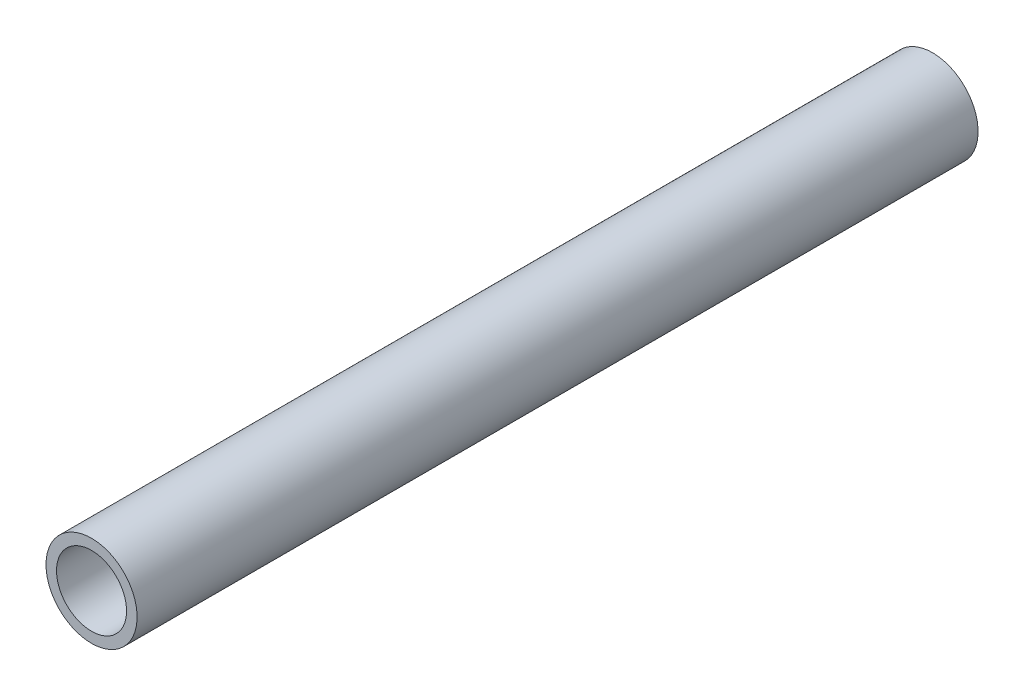
from build123d import *

# Parameters (mm, degrees)
SKETCH1_R           = 16.51
SKETCH1_R_2         = 12.7
BOSS_EXTRUDE1_DEPTH = 304.8


with BuildPart() as part:
    # Sketch1 → Boss-Extrude1 (new body)
    with BuildSketch(Plane.XY):
        with Locations(Location((0, 0, 0), (0, 0, 180))):
            Circle(SKETCH1_R)
        with Locations(Location((0, 0, 0), (0, 0, 180))):
            Circle(SKETCH1_R_2, mode=Mode.SUBTRACT)
    extrude(amount=BOSS_EXTRUDE1_DEPTH)


solid = part.part
